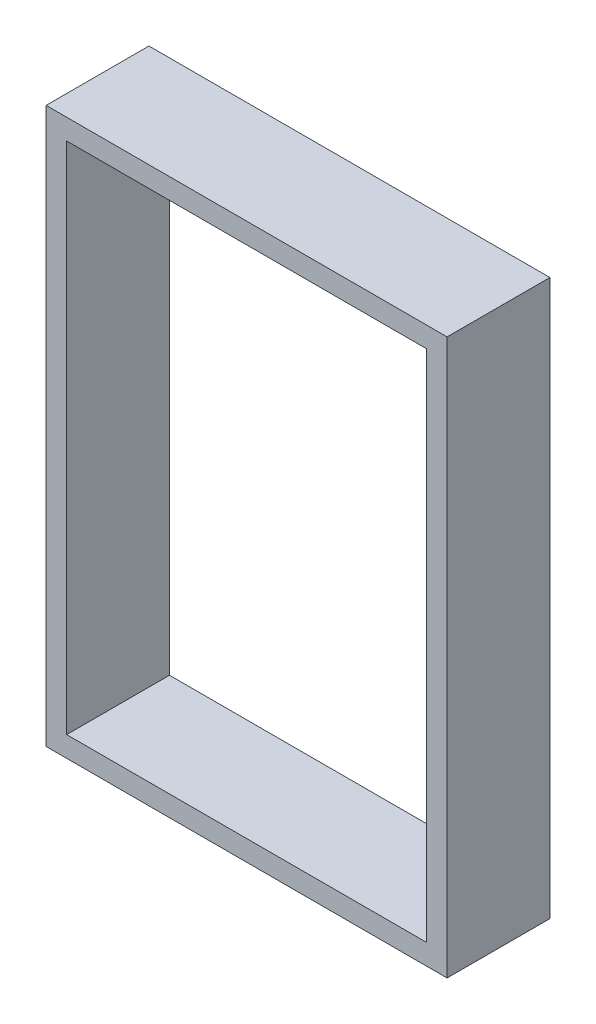
from build123d import *

# Parameters (mm, degrees)
SKETCH_1_W      = 3.9
SKETCH_1_H      = 5.4
SKETCH_1_W_2    = 3.5
SKETCH_1_H_2    = 5
EXTRUDE_1_DEPTH = 1


with BuildPart() as part:
    # 草图1 → 凸台-拉伸1 (new body)
    with BuildSketch(Plane.XY):
        Rectangle(SKETCH_1_W, SKETCH_1_H)
        Rectangle(SKETCH_1_W_2, SKETCH_1_H_2, mode=Mode.SUBTRACT)
    extrude(amount=EXTRUDE_1_DEPTH)


solid = part.part
